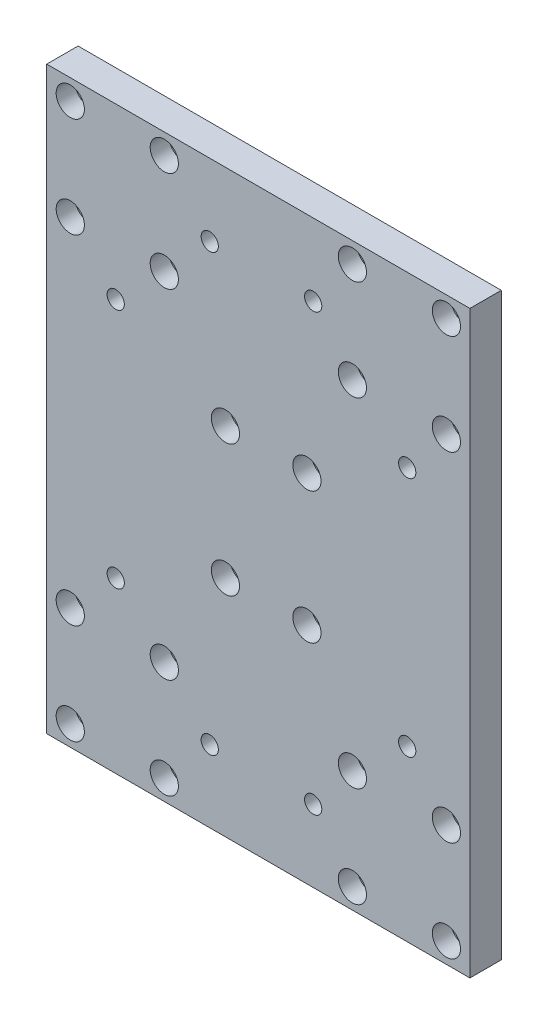
from build123d import *

# Parameters (mm, degrees)
SZKIC1_W                                             = 135
SZKIC1_H                                             = 185
DODANIE_WYCI_GNI_CIE1_DEPTH                          = 10
POG_BIENIE_WALCOWE_POD_M5_WKR_T_DO_CZ_CI_D           = 5.5
POG_BIENIE_WALCOWE_POD_M5_WKR_T_DO_CZ_CI_CBORE_D     = 9
POG_BIENIE_WALCOWE_POD_M5_WKR_T_DO_CZ_CI_CBORE_DEPTH = 6
SZKIC5_R                                             = 2.75
WYTNIJ_WYCI_GNI_CIE1_DEPTH                           = 230.237867727
POG_BIENIE_WALCOWE_POD_M5_WKR_T_DO_C_2_D             = 5.5
POG_BIENIE_WALCOWE_POD_M5_WKR_T_DO_C_2_CBORE_D       = 9
POG_BIENIE_WALCOWE_POD_M5_WKR_T_DO_C_2_CBORE_DEPTH   = 6


with BuildPart() as part:
    # Szkic1 → Dodanie-wyciągnięcie1 (new body)
    with BuildSketch(Plane.XY):
        with Locations((67.5, 92.5)):
            Rectangle(SZKIC1_W, SZKIC1_H)
    extrude(amount=DODANIE_WYCI_GNI_CIE1_DEPTH)

    # Pog_bienie walcowe pod M5 Wkr_t do cz_ci (through all)
    with Locations(Plane.XY.offset(10)):
        with Locations((7.5, 178.5), (37.5, 178.5), (37.5, 146.5), (7.5, 146.5), (7.5, 38.5), (37.5, 38.5), (7.5, 6.5), (37.5, 6.5), (97.5, 6.5), (127.5, 6.5), (97.5, 38.5), (127.5, 38.5), (127.5, 146.5), (97.5, 146.5), (97.5, 178.5), (127.5, 178.5)):
            CounterBoreHole(POG_BIENIE_WALCOWE_POD_M5_WKR_T_DO_CZ_CI_D / 2, POG_BIENIE_WALCOWE_POD_M5_WKR_T_DO_CZ_CI_CBORE_D / 2, POG_BIENIE_WALCOWE_POD_M5_WKR_T_DO_CZ_CI_CBORE_DEPTH)

    # Szkic5 → Wytnij-wyciągnięcie1 (cut, through all)
    with BuildSketch(Plane.XY.offset(10)):
        with Locations((22, 54)):
            Circle(SZKIC5_R)
        with Locations((52, 23)):
            Circle(SZKIC5_R)
        with Locations((85, 23)):
            Circle(SZKIC5_R)
        with Locations((115, 54)):
            Circle(SZKIC5_R)
        with Locations(Location((52, 162, 0), (0, 0, 180))):
            Circle(SZKIC5_R)
        with Locations(Location((22, 131, 0), (0, 0, 180))):
            Circle(SZKIC5_R)
        with Locations(Location((115, 131, 0), (0, 0, 180))):
            Circle(SZKIC5_R)
        with Locations(Location((85, 162, 0), (0, 0, 180))):
            Circle(SZKIC5_R)
    extrude(amount=-WYTNIJ_WYCI_GNI_CIE1_DEPTH, mode=Mode.SUBTRACT)

    # Pog_bienie walcowe pod M5 Wkr_t do c 2 (through all)
    with Locations(Plane.XY.offset(10)):
        with Locations((83, 113.5), (57, 113.5), (57, 71.5), (83, 71.5)):
            CounterBoreHole(POG_BIENIE_WALCOWE_POD_M5_WKR_T_DO_C_2_D / 2, POG_BIENIE_WALCOWE_POD_M5_WKR_T_DO_C_2_CBORE_D / 2, POG_BIENIE_WALCOWE_POD_M5_WKR_T_DO_C_2_CBORE_DEPTH)


solid = part.part
